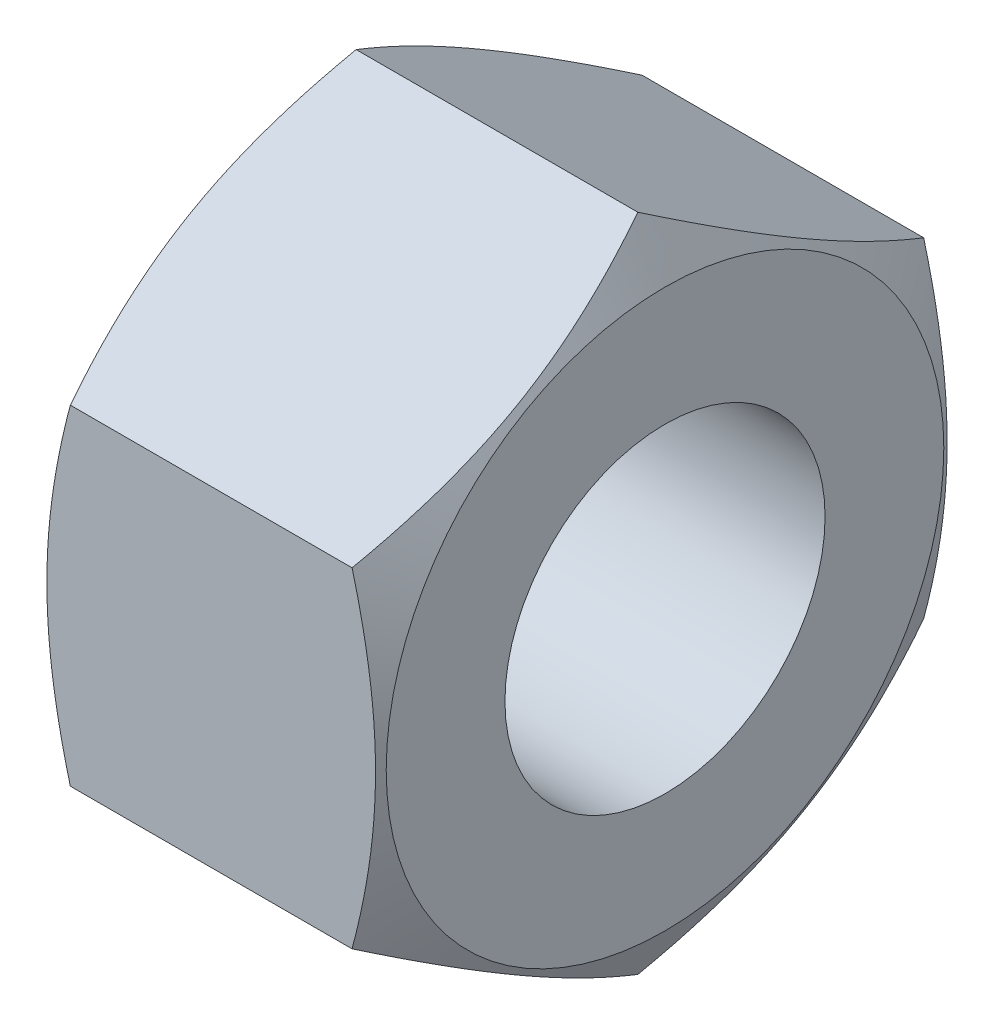
from build123d import *

# Parameters (mm, degrees)
BASE_DEPTH              = 4.1656
F_3_8_16_TAPPED_HOLE1_D = 7.9375


with BuildPart() as part:
    # Sketch1 → BASE (new, symmetric)
    with BuildSketch(Plane(origin=(0, 0, 0), x_dir=(0, 0, -1), z_dir=(1, 0, 0))):
        Polygon((0, 8.182900835), (-7.0866, 4.091450418), (-7.0866, -4.091450418), (0, -8.182900835), (7.0866, -4.091450418), (7.0866, 4.091450418), align=None)
    extrude(amount=BASE_DEPTH, both=True)

    # Sketch2 → EDGE-CUT (revolve, cut)
    with BuildSketch(Plane.XY, mode=Mode.PRIVATE) as edge_cut_sk:
        Polygon((4.1656, 6.912900835), (3.49291061, 8.182900835), (4.1656, 8.182900835), align=None)
    edge_cut = revolve(edge_cut_sk.sketch.rotate(Axis((0, 0, 0), (1, 0, 0)), 90), axis=Axis((0, 0, 0), (1, 0, 0)), mode=Mode.SUBTRACT)

    # Mirror1: EDGE-CUT across plane
    add(edge_cut.mirror(Plane(origin=(0, 0, 0), x_dir=(0, 0, 1), z_dir=(1, 0, 0))), mode=Mode.SUBTRACT)

    # 3/8-16 Tapped Hole1 (through all)
    with Locations(Plane(origin=(4.1656, 0, 0), x_dir=(0, 0, -1), z_dir=(1, 0, 0))):
        with Locations((0, 0)):
            Hole(F_3_8_16_TAPPED_HOLE1_D / 2)


solid = part.part
